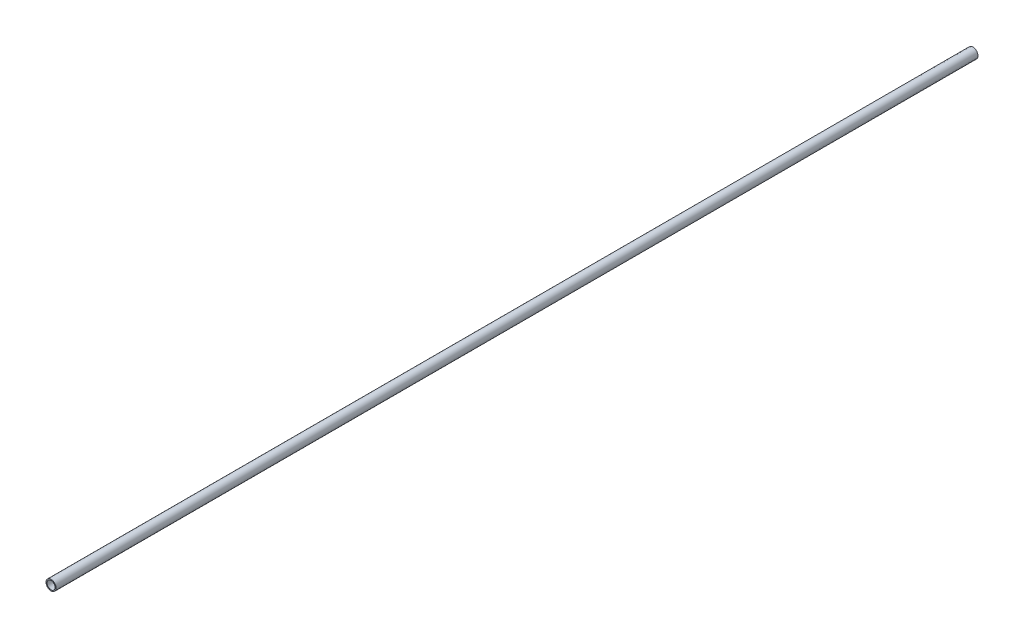
from build123d import *

# Parameters (mm, degrees)
SKETCH1_R           = 16.7005
SKETCH1_R_2         = 13.3223
EXTRUDE_THIN1_DEPTH = 1524


with BuildPart() as part:
    # Sketch1 → Extrude-Thin1 (new, symmetric)
    with BuildSketch(Plane.XY):
        Circle(SKETCH1_R)
        Circle(SKETCH1_R_2, mode=Mode.SUBTRACT)
    extrude(amount=EXTRUDE_THIN1_DEPTH, both=True)


solid = part.part
